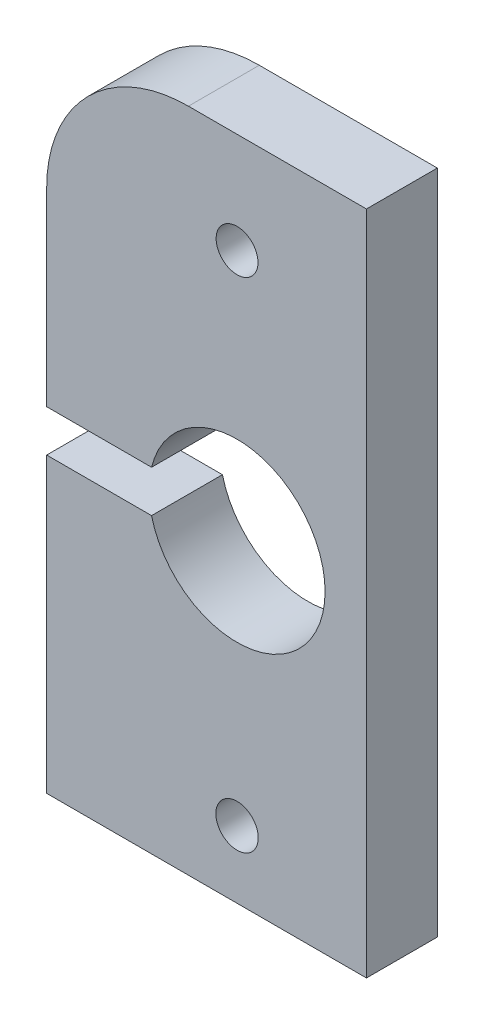
from build123d import *

# Parameters (mm, degrees)
SKETCH1_R           = 1.5
SKETCH1_R_2         = 1.517913389
BOSS_EXTRUDE1_DEPTH = 5.08


with BuildPart() as part:
    # Sketch1 → Boss-Extrude1 (new body)
    with BuildSketch(Plane(origin=(0, 0, 0), x_dir=(-1, 0, 0), z_dir=(0, 0, 1))):
        with BuildLine():
            Line((94.361674585, -64.328592097), (94.361674585, -111.794978321))
            Line((94.361674585, -111.794978321), (94.361674585, -112.062374013))
            Line((94.361674585, -112.062374013), (107.121412131, -112.062374013))
            ThreePointArc((107.121412131, -112.062374013), (114.305617027, -109.08657891), (117.281412131, -101.902374013))
            Line((117.281412131, -101.902374013), (117.281412131, -88.328738191))
            Line((117.281412131, -88.328738191), (113.735498826, -88.328738191))
            Line((113.735498826, -88.328738191), (110.405158411, -88.328738191))
            Line((110.405158411, -88.328738191), (109.76359006, -88.328738191))
            ThreePointArc((109.76359006, -88.328738191), (97.326662127, -86.828738191), (109.76359006, -85.328738191))
            Line((109.76359006, -85.328738191), (110.405158411, -85.328738191))
            Line((110.405158411, -85.328738191), (113.735498826, -85.328738191))
            Line((113.735498826, -85.328738191), (117.281412131, -85.328738191))
            Line((117.281412131, -85.328738191), (117.281412131, -64.328592097))
            Line((117.281412131, -64.328592097), (94.361674585, -64.328592097))
        make_face()
        with Locations((103.635582515, -104.844491412)):
            Circle(SKETCH1_R, mode=Mode.SUBTRACT)
        with Locations((103.635582515, -69.140487693)):
            Circle(SKETCH1_R_2, mode=Mode.SUBTRACT)
    extrude(amount=BOSS_EXTRUDE1_DEPTH)


solid = part.part
